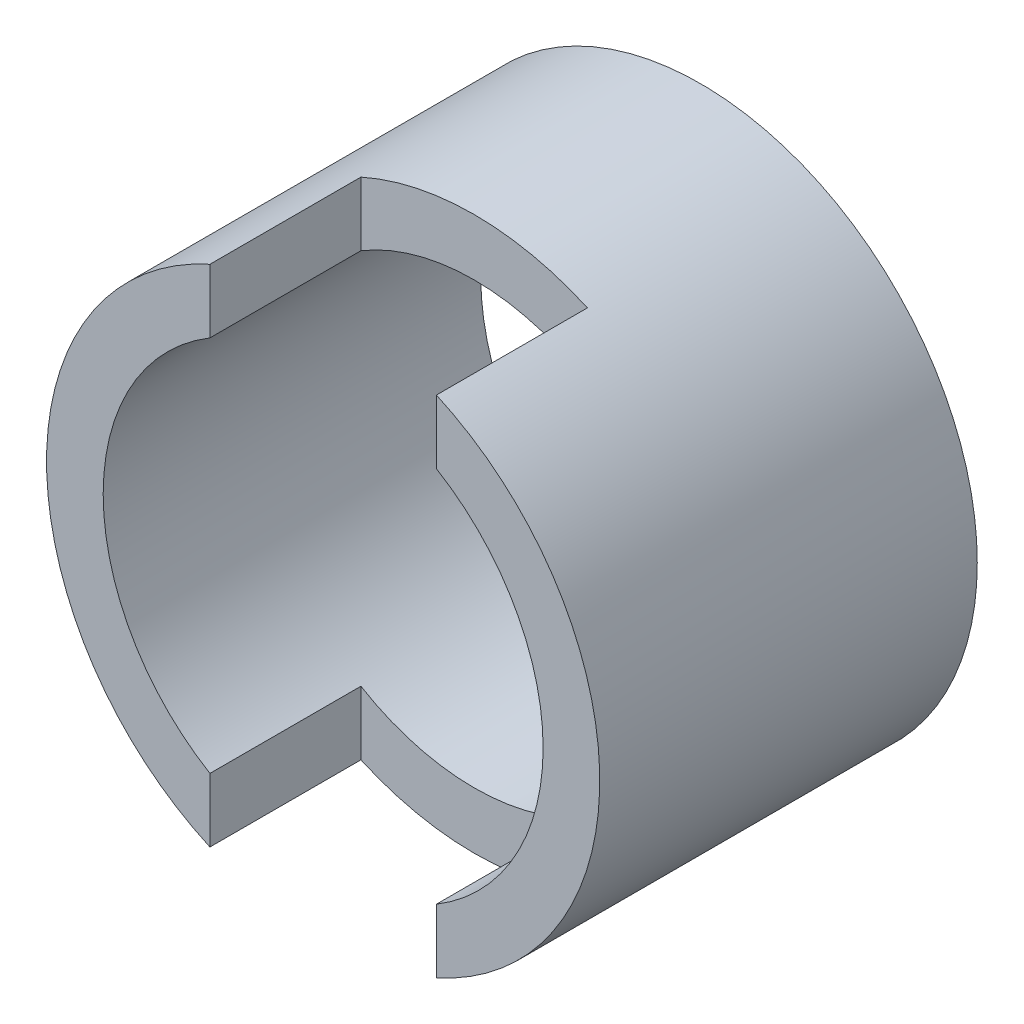
from build123d import *

# Parameters (mm, degrees)
SKETCH1_R           = 23.2625
SKETCH1_R_2         = 18.5
BOSS_EXTRUDE1_DEPTH = 31.75
SKETCH2_W           = 19.05
SKETCH2_H           = 50.8
CUT_EXTRUDE1_DEPTH  = 12.7


with BuildPart() as part:
    # Sketch1 → Boss-Extrude1 (new body)
    with BuildSketch(Plane.XY):
        Circle(SKETCH1_R)
        Circle(SKETCH1_R_2, mode=Mode.SUBTRACT)
    extrude(amount=BOSS_EXTRUDE1_DEPTH)

    # Sketch2 → Cut-Extrude1 (cut)
    with BuildSketch(Plane.XY.offset(31.75)):
        Rectangle(SKETCH2_W, SKETCH2_H)
    extrude(amount=-CUT_EXTRUDE1_DEPTH, mode=Mode.SUBTRACT)


solid = part.part
